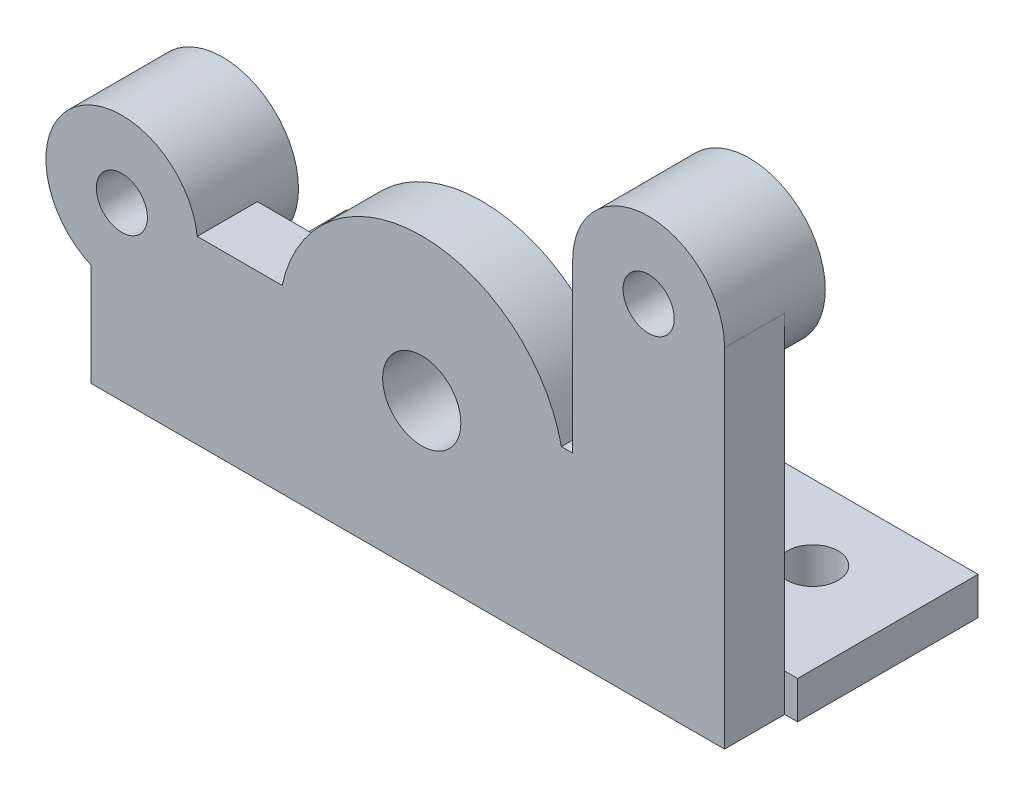
from build123d import *

# Parameters (mm, degrees)
SKETCH1_W           = 41
SKETCH1_H           = 12
BOSS_EXTRUDE1_DEPTH = 4
SKETCH2_R           = 9.5
SKETCH2_R_2         = 2.6
BOSS_EXTRUDE2_DEPTH = 4
SKETCH3_R           = 5.05
BOSS_EXTRUDE3_DEPTH = 4
SKETCH4_R           = 5.05
BOSS_EXTRUDE4_DEPTH = 4
SKETCH5_W           = 10.1
SKETCH5_H           = 23.124939501
BOSS_EXTRUDE5_DEPTH = 4
SKETCH6_W           = 42
SKETCH6_H           = 12
SKETCH6_R           = 1.7
BOSS_EXTRUDE6_DEPTH = 2.5
SKETCH7_R           = 2.6
CUT_EXTRUDE1_DEPTH  = 4
SKETCH8_R           = 5.05
BOSS_EXTRUDE7_DEPTH = 2.7
SKETCH9_R           = 1.7
CUT_EXTRUDE2_DEPTH  = 6.7


with BuildPart() as part:
    # Sketch1 → Boss-Extrude1 (new body)
    with BuildSketch(Plane.XY.offset(343.5)):
        with Locations((298.5, 36)):
            Rectangle(SKETCH1_W, SKETCH1_H)
    extrude(amount=BOSS_EXTRUDE1_DEPTH)

    # Sketch2 → Boss-Extrude2 (add)
    with BuildSketch(Plane.XY.offset(343.5)):
        with Locations((300, 40)):
            Circle(SKETCH2_R)
        with Locations((300, 40)):
            Circle(SKETCH2_R_2, mode=Mode.SUBTRACT)
    extrude(amount=BOSS_EXTRUDE2_DEPTH)

    # Sketch4 → Boss-Extrude4 (add)
    with BuildSketch(Plane.XY.offset(343.5)):
        with Locations((280.050647312, 41.422437104)):
            Circle(SKETCH4_R)
    extrude(amount=BOSS_EXTRUDE4_DEPTH)



with BuildPart() as body_2:
    # Sketch3 → Boss-Extrude3 (new body)
    with BuildSketch(Plane.XY.offset(343.5)):
        with Locations((315.090923202, 53.124939501)):
            Circle(SKETCH3_R)
    extrude(amount=BOSS_EXTRUDE3_DEPTH)


with BuildPart() as part_1:
    add(part.part)

    add(body_2.part)  # Boss-Extrude5 merges body 2
    # Sketch5 → Boss-Extrude5 (add)
    with BuildSketch(Plane.XY.offset(343.5)):
        with Locations((315.090923202, 41.562469751)):
            Rectangle(SKETCH5_W, SKETCH5_H)
    extrude(amount=BOSS_EXTRUDE5_DEPTH)

    # Sketch6 → Boss-Extrude6 (add)
    with BuildSketch(Plane(origin=(0, 30, 0), x_dir=(1, 0, 0), z_dir=(0, 1, 0))):
        with Locations((300, -337.5)):
            Rectangle(SKETCH6_W, SKETCH6_H)
        with Locations(Location((285, -336.5, 0), (0, 0, 270))):
            Circle(SKETCH6_R, mode=Mode.SUBTRACT)
        with Locations(Location((315, -336.5, 0), (0, 0, 270))):
            Circle(SKETCH6_R, mode=Mode.SUBTRACT)
    extrude(amount=BOSS_EXTRUDE6_DEPTH)

    # Sketch7 → Cut-Extrude1 (cut)
    with BuildSketch(Plane.XY.offset(343.5)):
        with Locations((300, 40)):
            Circle(SKETCH7_R)
    extrude(amount=CUT_EXTRUDE1_DEPTH, mode=Mode.SUBTRACT)

    # Sketch8 → Boss-Extrude7 (add)
    with BuildSketch(Plane.XY.offset(340.8)):
        with Locations((315.090923202, 53.124939501)):
            Circle(SKETCH8_R)
        with Locations(Location((280.050647312, 41.422437104, 0), (0, 0, 246.041880591))):
            Circle(SKETCH8_R)
    extrude(amount=BOSS_EXTRUDE7_DEPTH)

    # Sketch9 → Cut-Extrude2 (cut)
    with BuildSketch(Plane.XY.offset(340.8)):
        with Locations(Location((315.090923202, 53.124939501, 0), (0, 0, 180))):
            Circle(SKETCH9_R)
        with Locations(Location((280.050647312, 41.422437104, 0), (0, 0, 180))):
            Circle(SKETCH9_R)
    extrude(amount=CUT_EXTRUDE2_DEPTH, mode=Mode.SUBTRACT)


solid = part_1.part
